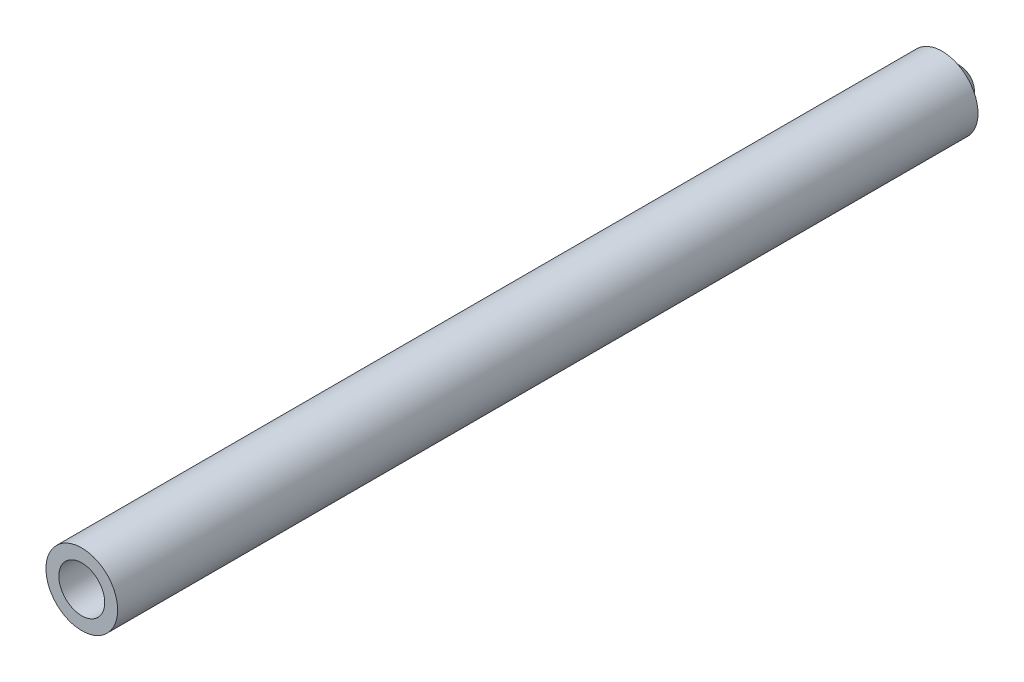
from build123d import *

# Parameters (mm, degrees)
SKETCH5_R           = 62.5
SKETCH5_R_2         = 40
BOSS_EXTRUDE3_DEPTH = 1500


with BuildPart() as part:
    # Sketch5 → Boss-Extrude3 (new body)
    with BuildSketch(Plane.XY):
        Circle(SKETCH5_R)
        Circle(SKETCH5_R_2, mode=Mode.SUBTRACT)
    extrude(amount=BOSS_EXTRUDE3_DEPTH)


with BuildPart() as body_2:
    # Sketch7 → Revolve1 (revolve)
    with BuildSketch(Plane(origin=(0, 0, 0), x_dir=(-1, 0, 0), z_dir=(0, 0, -1))):
        with BuildLine():
            Line((-40, 0), (40, 0))
            ThreePointArc((40, 0), (0, 40), (-40, 0))
        make_face()
    revolve(axis=Axis((40, 0, 0), (-1, 0, 0)))


solid = Compound([part.part, body_2.part])
